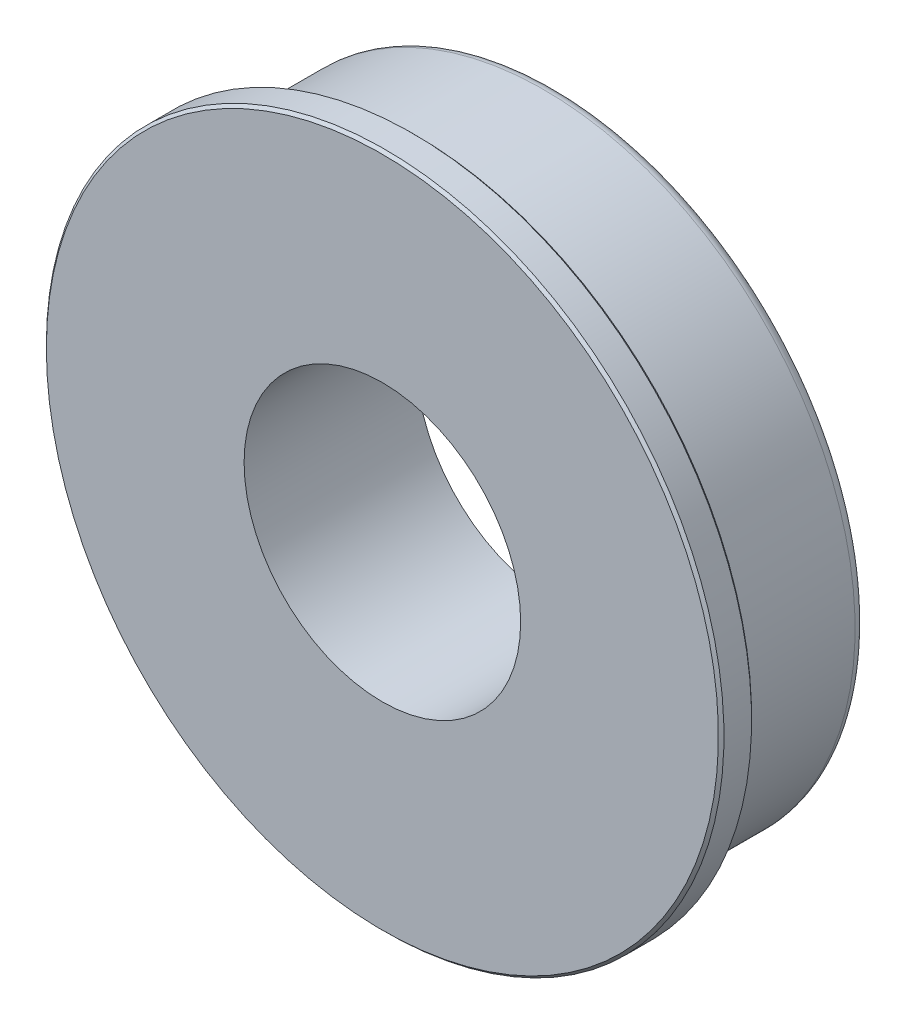
from build123d import *


with BuildPart() as part:
    # Sketch1 → Revolve1 (revolve)
    with BuildSketch(Plane.XZ, mode=Mode.PRIVATE) as revolve1_sk:
        with BuildLine():
            Line((14.2875, 0.508), (14.2875, 5.89534))
            Line((14.2875, 5.89534), (13.97, 5.89534))
            Line((13.97, 5.89534), (13.97, 6.40334))
            Line((13.97, 6.40334), (15.4305, 6.40334))
            Line((15.4305, 6.40334), (15.5575, 6.53034))
            Line((15.5575, 6.53034), (15.5575, 7.80034))
            Line((15.5575, 7.80034), (15.4305, 7.92734))
            Line((15.4305, 7.92734), (6.35, 7.92734))
            Line((6.35, 7.92734), (6.35, 0))
            Line((6.35, 0), (13.7795, 0))
            ThreePointArc((13.7795, 0), (14.138710245, 0.148789755), (14.2875, 0.508))
        make_face()
    revolve(revolve1_sk.sketch.rotate(Axis((0, 0, 7.92734), (0, 0, -1)), 180), axis=Axis((0, 0, 7.92734), (0, 0, -1)))


solid = part.part
